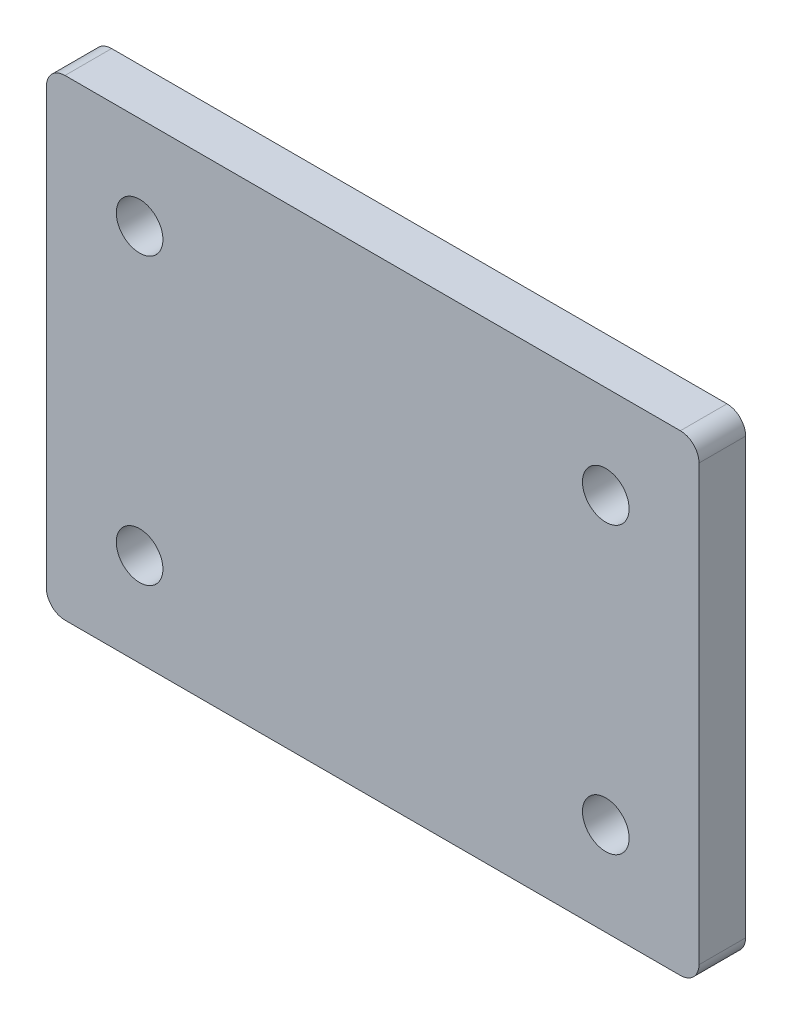
from build123d import *

# Parameters (mm, degrees)
SKETCH1_W           = 88.9
SKETCH1_H           = 64.25946
BOSS_EXTRUDE1_DEPTH = 6.35
FILLET1_R           = 2.54
SKETCH2_R           = 3.175
CUT_EXTRUDE1_DEPTH  = 6.35


with BuildPart() as part:
    # Sketch1 → Boss-Extrude1 (new body)
    with BuildSketch(Plane.XY):
        Rectangle(SKETCH1_W, SKETCH1_H)
    extrude(amount=BOSS_EXTRUDE1_DEPTH)

    # Fillet1
    fillet1_edges = [part.edges().sort_by_distance(p)[0] for p in [
        (44.45, -32.12973, 3.175),
        (-44.45, -32.12973, 3.175),
        (-44.45, 32.12973, 3.175),
        (44.45, 32.12973, 3.175),
    ]]
    fillet(fillet1_edges, radius=FILLET1_R)

    # Sketch2 → Cut-Extrude1 (cut)
    with BuildSketch(Plane.XY.offset(6.35)):
        with Locations((-31.75, 19.42973)):
            Circle(SKETCH2_R)
        with Locations((31.75, 19.42973)):
            Circle(SKETCH2_R)
        with Locations((31.75, -19.42973)):
            Circle(SKETCH2_R)
        with Locations((-31.75, -19.42973)):
            Circle(SKETCH2_R)
    extrude(amount=-CUT_EXTRUDE1_DEPTH, mode=Mode.SUBTRACT)


solid = part.part
